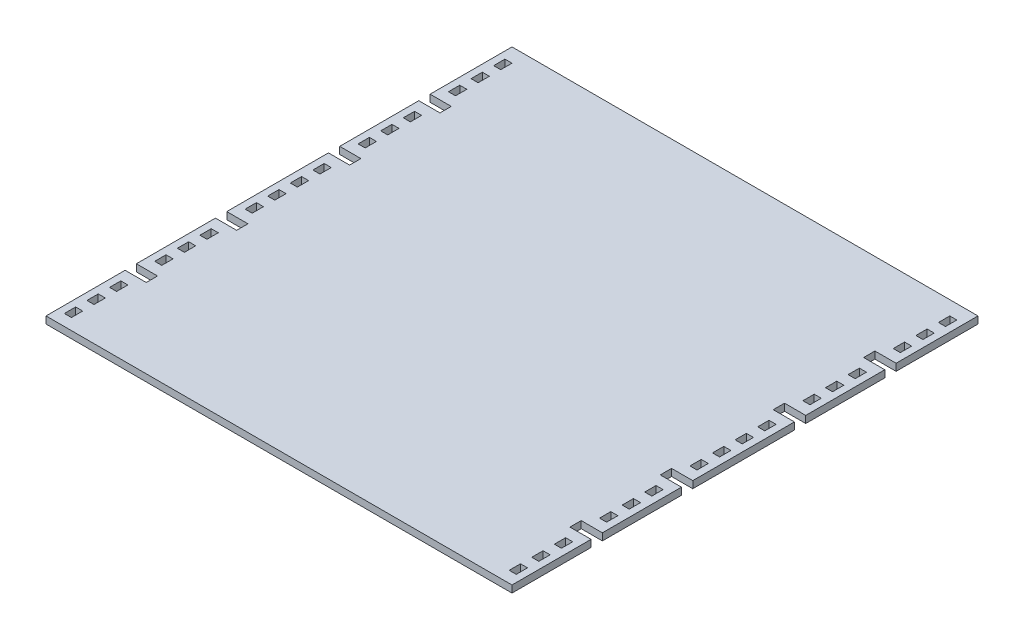
from build123d import *

# Parameters (mm, degrees)
SKETCH2_W           = 3.175
SKETCH2_H           = 5.08
BOSS_EXTRUDE1_DEPTH = 3.175


with BuildPart() as part:
    # Sketch2 → Boss-Extrude1 (new body)
    with BuildSketch(Plane(origin=(0, 0, 0), x_dir=(1, 0, 0), z_dir=(0, 1, 0))):
        Polygon((-58.640729436, -170.164220965), (150.909270564, -170.164220965), (150.909270564, -134.604220965), (141.384270564, -134.604220965), (141.384270564, -129.524220965), (150.909270564, -129.524220965), (150.909270564, -93.964220965), (141.384270564, -93.964220965), (141.384270564, -88.884220965), (150.909270564, -88.884220965), (150.909270564, -43.164220965), (141.384270564, -43.164220965), (141.384270564, -38.084220965), (150.909270564, -38.084220965), (150.909270564, -2.524220965), (141.384270564, -2.524220965), (141.384270564, 2.555779035), (150.909270564, 2.555779035), (150.909270564, 39.385779035), (-58.640729436, 39.385779035), (-58.640729436, 2.555779035), (-49.115729436, 2.555779035), (-49.115729436, -2.524220965), (-58.640729436, -2.524220965), (-58.640729436, -38.084220965), (-49.115729436, -38.084220965), (-49.115729436, -43.164220965), (-58.640729436, -43.164220965), (-58.640729436, -88.884220965), (-49.115729436, -88.884220965), (-49.115729436, -93.964220965), (-58.640729436, -93.964220965), (-58.640729436, -129.524220965), (-49.115729436, -129.524220965), (-49.115729436, -134.604220965), (-58.640729436, -134.604220965), align=None)
        with Locations((-53.878229436, -162.544220965)):
            Rectangle(SKETCH2_W, SKETCH2_H, mode=Mode.SUBTRACT)
        with Locations((146.146770564, -162.544220965)):
            Rectangle(SKETCH2_W, SKETCH2_H, mode=Mode.SUBTRACT)
        with Locations((-53.878229436, -152.384220965)):
            Rectangle(SKETCH2_W, SKETCH2_H, mode=Mode.SUBTRACT)
        with Locations((-53.878229436, -142.224220965)):
            Rectangle(SKETCH2_W, SKETCH2_H, mode=Mode.SUBTRACT)
        with Locations((-53.878229436, -121.904220965)):
            Rectangle(SKETCH2_W, SKETCH2_H, mode=Mode.SUBTRACT)
        with Locations((-53.878229436, -111.744220965)):
            Rectangle(SKETCH2_W, SKETCH2_H, mode=Mode.SUBTRACT)
        with Locations((-53.878229436, -101.584220965)):
            Rectangle(SKETCH2_W, SKETCH2_H, mode=Mode.SUBTRACT)
        with Locations((-53.878229436, -81.264220965)):
            Rectangle(SKETCH2_W, SKETCH2_H, mode=Mode.SUBTRACT)
        with Locations((-53.878229436, -71.104220965)):
            Rectangle(SKETCH2_W, SKETCH2_H, mode=Mode.SUBTRACT)
        with Locations((-53.878229436, -60.944220965)):
            Rectangle(SKETCH2_W, SKETCH2_H, mode=Mode.SUBTRACT)
        with Locations((-53.878229436, -50.784220965)):
            Rectangle(SKETCH2_W, SKETCH2_H, mode=Mode.SUBTRACT)
        with Locations((-53.878229436, -30.464220965)):
            Rectangle(SKETCH2_W, SKETCH2_H, mode=Mode.SUBTRACT)
        with Locations((-53.878229436, -20.304220965)):
            Rectangle(SKETCH2_W, SKETCH2_H, mode=Mode.SUBTRACT)
        with Locations((-53.878229436, -10.144220965)):
            Rectangle(SKETCH2_W, SKETCH2_H, mode=Mode.SUBTRACT)
        with Locations((-53.878229436, 10.175779035)):
            Rectangle(SKETCH2_W, SKETCH2_H, mode=Mode.SUBTRACT)
        with Locations((-53.878229436, 20.335779035)):
            Rectangle(SKETCH2_W, SKETCH2_H, mode=Mode.SUBTRACT)
        with Locations((-53.878229436, 30.495779035)):
            Rectangle(SKETCH2_W, SKETCH2_H, mode=Mode.SUBTRACT)
        with Locations((146.146770564, 30.495779035)):
            Rectangle(SKETCH2_W, SKETCH2_H, mode=Mode.SUBTRACT)
        with Locations((146.146770564, 20.335779035)):
            Rectangle(SKETCH2_W, SKETCH2_H, mode=Mode.SUBTRACT)
        with Locations((146.146770564, 10.175779035)):
            Rectangle(SKETCH2_W, SKETCH2_H, mode=Mode.SUBTRACT)
        with Locations((146.146770564, -10.144220965)):
            Rectangle(SKETCH2_W, SKETCH2_H, mode=Mode.SUBTRACT)
        with Locations((146.146770564, -20.304220965)):
            Rectangle(SKETCH2_W, SKETCH2_H, mode=Mode.SUBTRACT)
        with Locations((146.146770564, -30.464220965)):
            Rectangle(SKETCH2_W, SKETCH2_H, mode=Mode.SUBTRACT)
        with Locations((146.146770564, -50.784220965)):
            Rectangle(SKETCH2_W, SKETCH2_H, mode=Mode.SUBTRACT)
        with Locations((146.146770564, -60.944220965)):
            Rectangle(SKETCH2_W, SKETCH2_H, mode=Mode.SUBTRACT)
        with Locations((146.146770564, -71.104220965)):
            Rectangle(SKETCH2_W, SKETCH2_H, mode=Mode.SUBTRACT)
        with Locations((146.146770564, -81.264220965)):
            Rectangle(SKETCH2_W, SKETCH2_H, mode=Mode.SUBTRACT)
        with Locations((146.146770564, -101.584220965)):
            Rectangle(SKETCH2_W, SKETCH2_H, mode=Mode.SUBTRACT)
        with Locations((146.146770564, -111.744220965)):
            Rectangle(SKETCH2_W, SKETCH2_H, mode=Mode.SUBTRACT)
        with Locations((146.146770564, -121.904220965)):
            Rectangle(SKETCH2_W, SKETCH2_H, mode=Mode.SUBTRACT)
        with Locations((146.146770564, -142.224220965)):
            Rectangle(SKETCH2_W, SKETCH2_H, mode=Mode.SUBTRACT)
        with Locations((146.146770564, -152.384220965)):
            Rectangle(SKETCH2_W, SKETCH2_H, mode=Mode.SUBTRACT)
    extrude(amount=BOSS_EXTRUDE1_DEPTH)


solid = part.part
